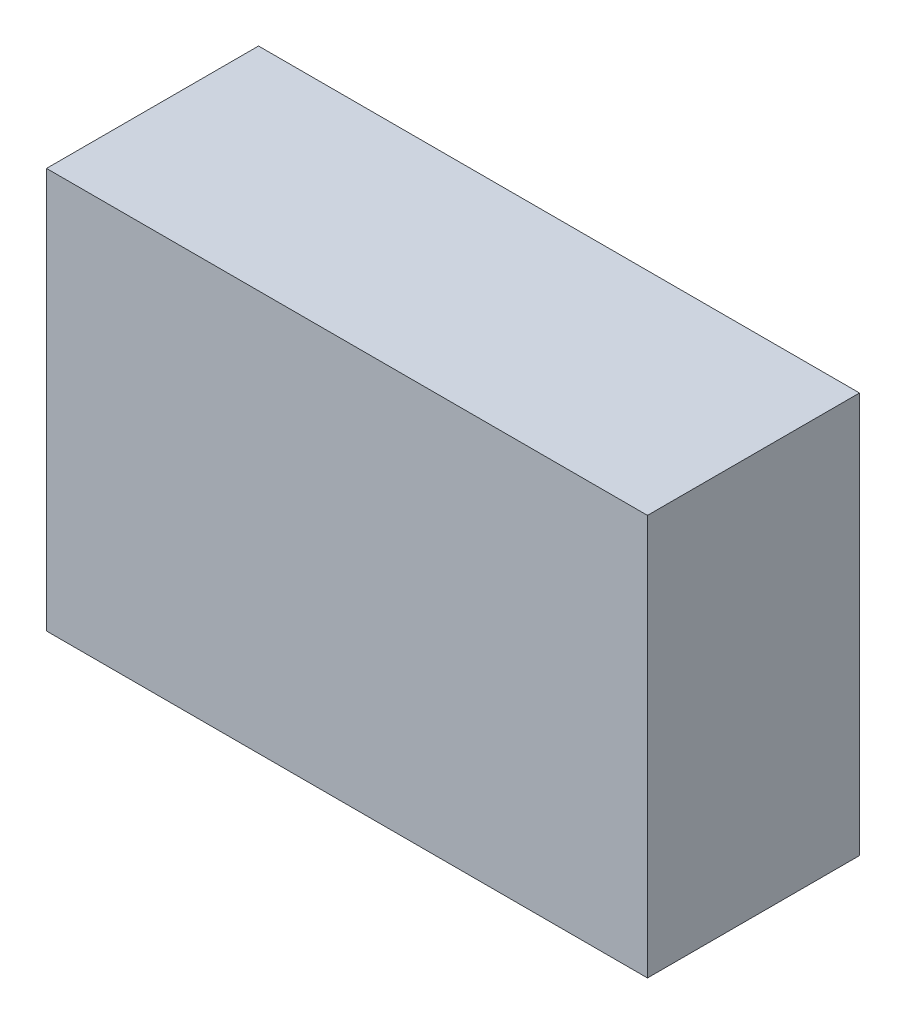
from build123d import *

# Parameters (mm, degrees)
SKETCH1_W           = 18
SKETCH1_H           = 12
BOSS_EXTRUDE1_DEPTH = 6.35


with BuildPart() as part:
    # Sketch1 → Boss-Extrude1 (new body)
    with BuildSketch(Plane.XY):
        with Locations((0, 82.5)):
            Rectangle(SKETCH1_W, SKETCH1_H)
    extrude(amount=-BOSS_EXTRUDE1_DEPTH)


solid = part.part
